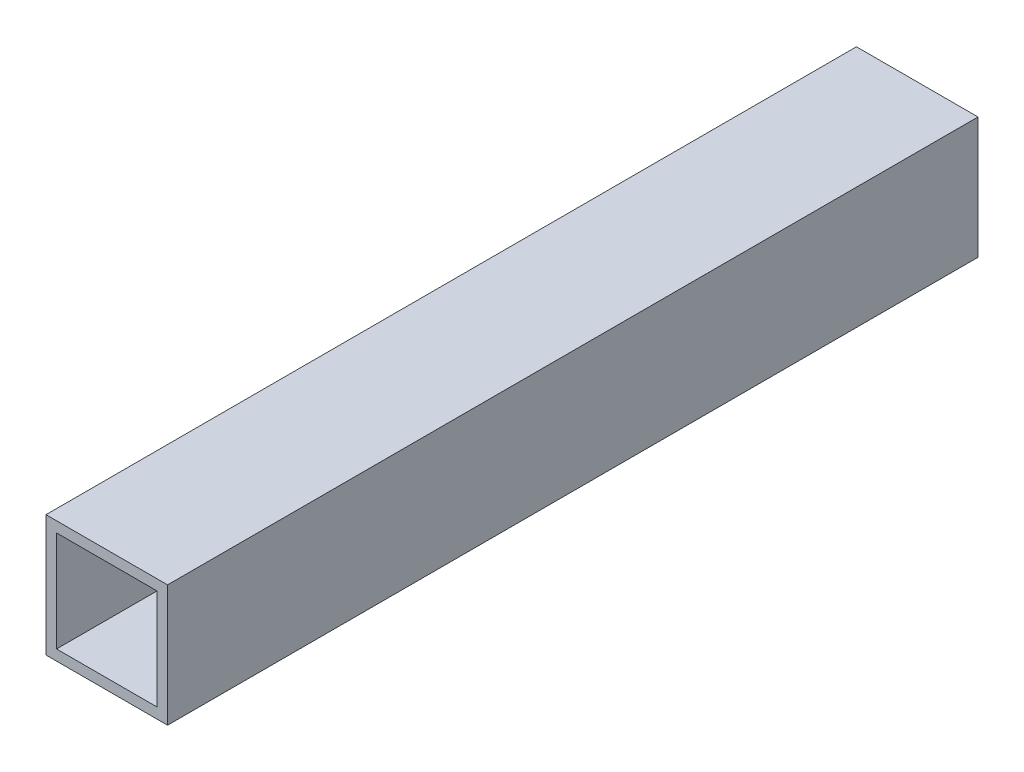
from build123d import *

# Parameters (mm, degrees)
SKETCH1_W      = 38.1
SKETCH1_H      = 38.1
SKETCH1_W_2    = 31.496
SKETCH1_H_2    = 31.496
EXTRUDE1_DEPTH = 254


with BuildPart() as part:
    # Sketch1 → Extrude1 (new body)
    with BuildSketch(Plane.XY):
        Rectangle(SKETCH1_W, SKETCH1_H)
        Rectangle(SKETCH1_W_2, SKETCH1_H_2, mode=Mode.SUBTRACT)
    extrude(amount=EXTRUDE1_DEPTH)


solid = part.part
